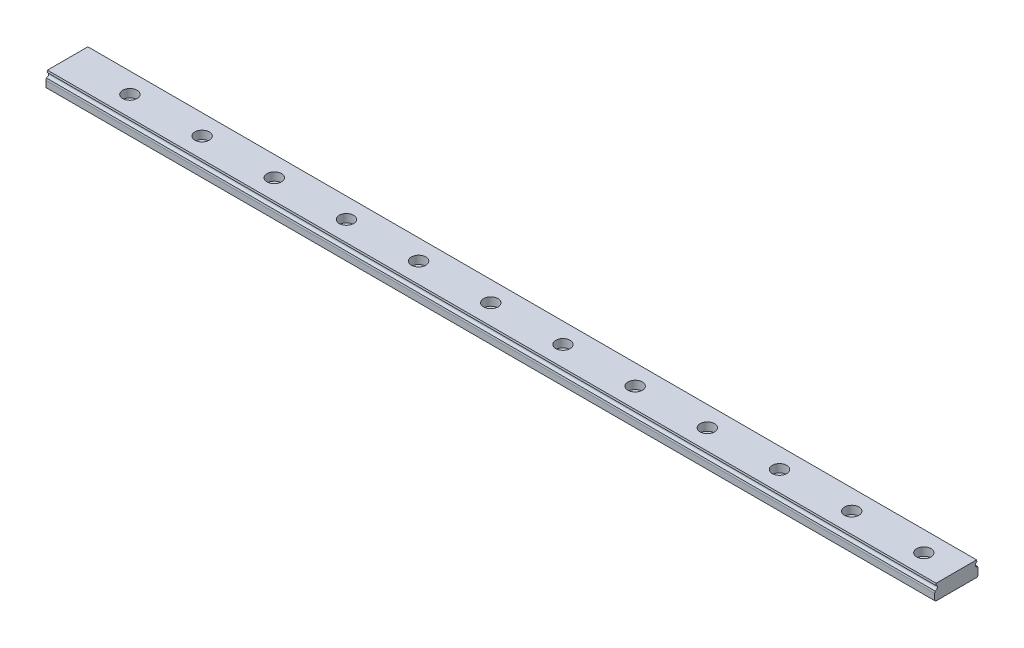
from build123d import *

# Parameters (mm, degrees)
RESSALTO_EXTRUS_O1_DEPTH      = 353
RESSALTO_EXTRUS_O1_DEPTH_BACK = 139.5
LPATTERN1_COUNT               = 8
LPATTERN1_PITCH               = 40
LPATTERN1_COL_COUNT           = 5
LPATTERN1_COL_PITCH           = 40


with BuildPart() as part:
    # Esboço1 → Ressalto-extrusão1 (new, two sides: drawn at the far end of the back side and taken through both)
    with BuildSketch(Plane(origin=(-15, 0, 0), x_dir=(0, 0, -1), z_dir=(1, 0, 0)).offset(-RESSALTO_EXTRUS_O1_DEPTH_BACK)):
        with BuildLine():
            Line((-12, 4), (-12, 0.5))
            Line((-12, 0.5), (-11.5, 0))
            Line((-11.5, 0), (11.5, 0))
            Line((11.5, 0), (12, 0.5))
            Line((12, 0.5), (12, 4))
            Line((12, 4), (11.814562479, 5.051668439))
            ThreePointArc((11.814562479, 5.051668439), (10.518990309, 6.082939778), (11.383714346, 7.495129625))
            Line((11.383714346, 7.495129625), (11.206528587, 8.5))
            Line((11.206528587, 8.5), (-11.206528587, 8.5))
            Line((-11.206528587, 8.5), (-11.383714346, 7.495129625))
            ThreePointArc((-11.383714346, 7.495129625), (-10.518990309, 6.082939778), (-11.814562479, 5.051668439))
            Line((-11.814562479, 5.051668439), (-12, 4))
        make_face()
    extrude(amount=RESSALTO_EXTRUS_O1_DEPTH + RESSALTO_EXTRUS_O1_DEPTH_BACK)

    # Esboço3 → Corte-Revolução2 (revolve, cut)
    with BuildSketch(Plane.XY, mode=Mode.PRIVATE) as corte_revolu_o2_sk:
        Polygon((40, 8.5), (44, 8.5), (44, 4), (42.25, 4), (42.25, 0), (40, 0), align=None)
    corte_revolu_o2 = revolve(corte_revolu_o2_sk.sketch.rotate(Axis((40, 0, 0), (0, 1, 0)), 270), axis=Axis((40, 0, 0), (0, 1, 0)), mode=Mode.SUBTRACT)

    # LPattern1: Corte-Revolução2 ×8
    with Locations(*[(i * LPATTERN1_PITCH, 0, 0) for i in range(1, LPATTERN1_COUNT)]):
        add(corte_revolu_o2, mode=Mode.SUBTRACT)

    # LPattern1 col: Corte-Revolução2 ×5
    with Locations(*[(-i * LPATTERN1_COL_PITCH, 0, 0) for i in range(1, LPATTERN1_COL_COUNT)]):
        add(corte_revolu_o2, mode=Mode.SUBTRACT)


solid = part.part
